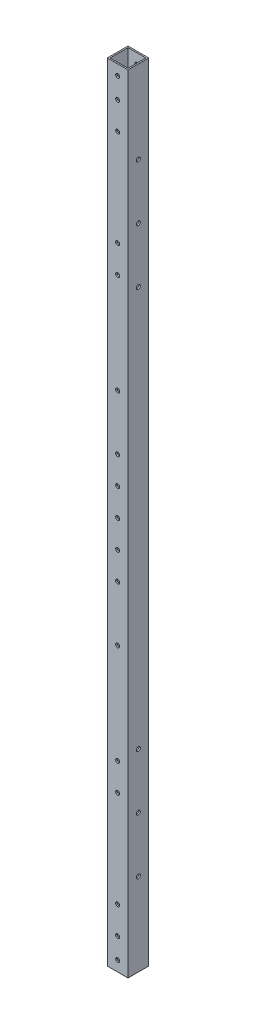
from build123d import *

# Parameters (mm, degrees)
SKETCH_1_W               = 15
SKETCH_1_H               = 15
SKETCH_1_W_2             = 13
SKETCH_1_H_2             = 13
EXTRUDE_1_DEPTH          = 570
CUT_EXTRUDE_1_DEPTH      = 10
CUT_EXTRUDE_1_DEPTH_BACK = 571.098675669
SKETCH_2_R               = 1.45
SKETCH_3_R               = 1.45
CUT_EXTRUDE_2_DEPTH      = 571.246657158


with BuildPart() as part:
    # 草图1 → 拉伸-薄壁1 (new body)
    with BuildSketch(Plane(origin=(0, 0, 0), x_dir=(1, 0, 0), z_dir=(0, 1, 0))):
        Rectangle(SKETCH_1_W, SKETCH_1_H)
        Rectangle(SKETCH_1_W_2, SKETCH_1_H_2, mode=Mode.SUBTRACT)
    extrude(amount=EXTRUDE_1_DEPTH)

    # 草图2 → 切除-拉伸1 (cut, two sides: drawn at the far end of the back side and taken through both)
    with BuildSketch(Plane.XY.offset(-CUT_EXTRUDE_1_DEPTH_BACK)):
        with Locations(Location((0, 7.5, 0), (0, 0, 180))):
            Circle(SKETCH_2_R)
        with Locations(Location((0, 22.5, 0), (0, 0, 180))):
            Circle(SKETCH_2_R)
        with Locations(Location((0, 42.5, 0), (0, 0, 180))):
            Circle(SKETCH_2_R)
        with Locations(Location((0, 527.5, 0), (0, 0, 180))):
            Circle(SKETCH_2_R)
        with Locations(Location((0, 547.5, 0), (0, 0, 180))):
            Circle(SKETCH_2_R)
        with Locations(Location((0, 562.5, 0), (0, 0, 180))):
            Circle(SKETCH_2_R)
        with Locations(Location((0, 285, 0), (0, 0, 180))):
            Circle(SKETCH_2_R)
        with Locations(Location((0, 305, 0), (0, 0, 180))):
            Circle(SKETCH_2_R)
        with Locations(Location((0, 265, 0), (0, 0, 180))):
            Circle(SKETCH_2_R)
        with Locations(Location((0, 112.5, 0), (0, 0, 180))):
            Circle(SKETCH_2_R)
        with Locations(Location((0, 132.5, 0), (0, 0, 180))):
            Circle(SKETCH_2_R)
        with Locations(Location((0, 437.5, 0), (0, 0, 180))):
            Circle(SKETCH_2_R)
        with Locations(Location((0, 457.5, 0), (0, 0, 180))):
            Circle(SKETCH_2_R)
        with Locations(Location((0, 245, 0), (0, 0, 180))):
            Circle(SKETCH_2_R)
        with Locations(Location((0, 205, 0), (0, 0, 180))):
            Circle(SKETCH_2_R)
        with Locations(Location((0, 365, 0), (0, 0, 180))):
            Circle(SKETCH_2_R)
        with Locations(Location((0, 325, 0), (0, 0, 180))):
            Circle(SKETCH_2_R)
    extrude(amount=CUT_EXTRUDE_1_DEPTH + CUT_EXTRUDE_1_DEPTH_BACK, mode=Mode.SUBTRACT)

    # 草图3 → 切除-拉伸2 (cut, through all)
    with BuildSketch(Plane(origin=(7.5, 0, 0), x_dir=(0, 0, -1), z_dir=(1, 0, 0))):
        with Locations((0, 60)):
            Circle(SKETCH_3_R)
        with Locations((0, 100)):
            Circle(SKETCH_3_R)
        with Locations((0, 470)):
            Circle(SKETCH_3_R)
        with Locations((0, 510)):
            Circle(SKETCH_3_R)
        with Locations((0, 140)):
            Circle(SKETCH_3_R)
        with Locations((0, 430)):
            Circle(SKETCH_3_R)
    extrude(amount=-CUT_EXTRUDE_2_DEPTH, mode=Mode.SUBTRACT)


solid = part.part
